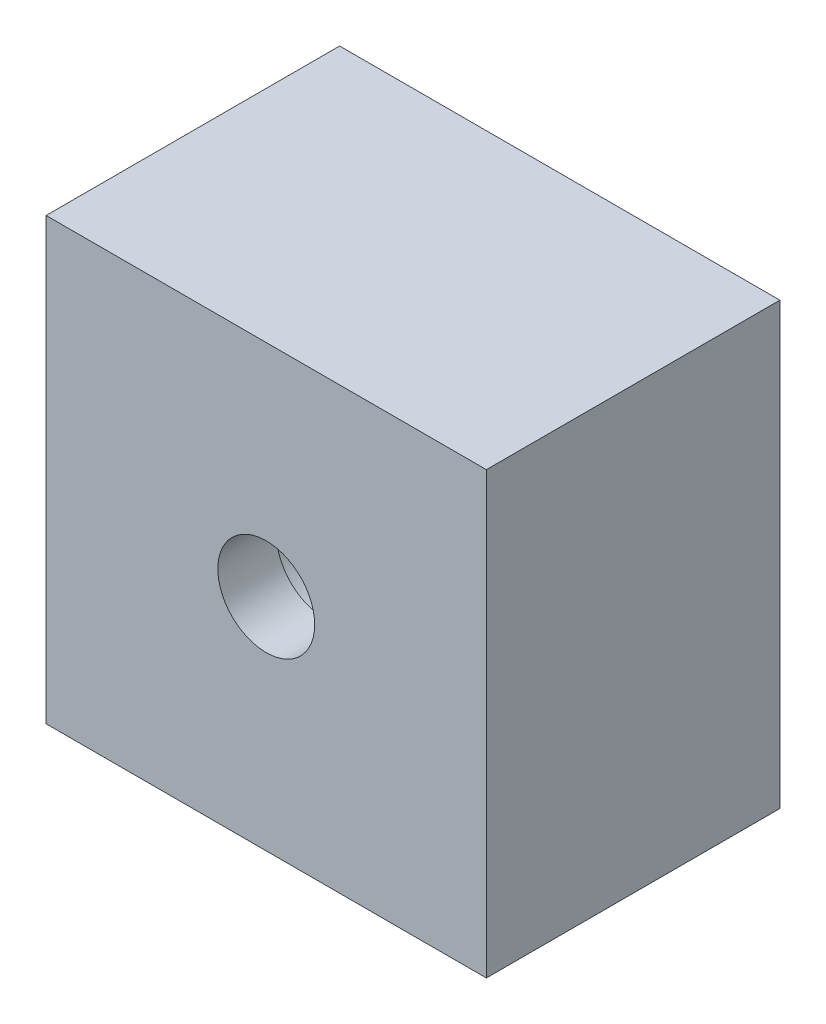
from build123d import *

# Parameters (mm, degrees)
SKETCH1_W           = 15
SKETCH1_H           = 15
SKETCH1_R           = 1.65
BOSS_EXTRUDE4_DEPTH = 10
SKETCH1_9_R         = 2.45
SKETCH1_9_R_2       = 1.65
CUT_EXTRUDE3_DEPTH  = 8


with BuildPart() as part:
    # Sketch1 → Boss-Extrude4 (new body)
    with BuildSketch(Plane.XY):
        Rectangle(SKETCH1_W, SKETCH1_H)
        Circle(SKETCH1_R, mode=Mode.SUBTRACT)
    extrude(amount=BOSS_EXTRUDE4_DEPTH)

    # Sketch1<9> → Cut-Extrude3 (cut)
    with BuildSketch(Plane.XY):
        Circle(SKETCH1_9_R)
        Circle(SKETCH1_9_R_2, mode=Mode.SUBTRACT)
    extrude(amount=CUT_EXTRUDE3_DEPTH, mode=Mode.SUBTRACT)


solid = part.part
